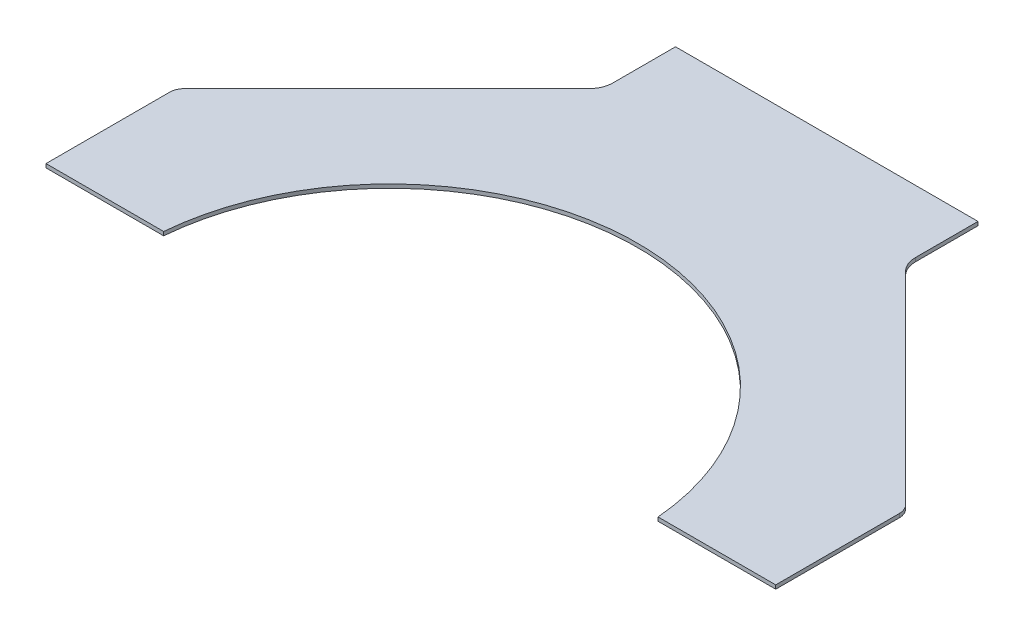
from build123d import *

# Parameters (mm, degrees)
BOSS_EXTRUDE1_DEPTH = 0.2


with BuildPart() as part:
    # Sketch1 → Boss-Extrude1 (new body)
    with BuildSketch(Plane(origin=(0, 0, 0), x_dir=(1, 0, 0), z_dir=(0, 1, 0))):
        with BuildLine():
            Line((-19.3, 1.125), (-13.076696831, 1.125))
            ThreePointArc((-13.076696831, 1.125), (0, 13.125), (13.076696831, 1.125))
            Line((13.076696831, 1.125), (19.3, 1.125))
            Line((19.3, 1.125), (19.3, 7.662950904))
            ThreePointArc((19.3, 7.662950904), (19.239103626, 7.969097649), (19.065685426, 8.228636327))
            Line((19.065685426, 8.228636327), (8.366116524, 18.928205229))
            ThreePointArc((8.366116524, 18.928205229), (8.095150585, 19.333734415), (8, 19.812088706))
            Line((8, 19.812088706), (8, 23.124999999))
            Line((8, 23.124999999), (-8, 23.124999999))
            Line((-8, 23.124999999), (-8, 19.812088706))
            ThreePointArc((-8, 19.812088706), (-8.095150585, 19.333734415), (-8.366116524, 18.928205229))
            Line((-8.366116524, 18.928205229), (-19.065685426, 8.228636327))
            ThreePointArc((-19.065685426, 8.228636327), (-19.239103626, 7.969097649), (-19.3, 7.662950904))
            Line((-19.3, 7.662950904), (-19.3, 1.125))
        make_face()
    extrude(amount=-BOSS_EXTRUDE1_DEPTH)


solid = part.part
